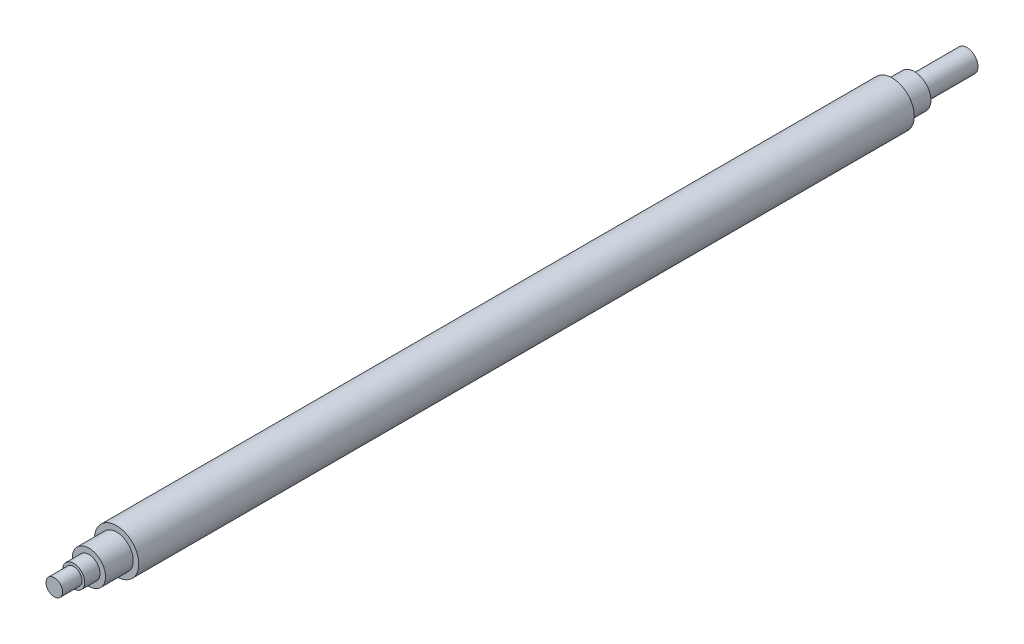
from build123d import *


with BuildPart() as part:
    # Schizzo2 → Rivoluzione2 (revolve)
    with BuildSketch(Plane(origin=(0, 0, 0), x_dir=(0, 0, -1), z_dir=(1, 0, 0)), mode=Mode.PRIVATE) as rivoluzione2_sk:
        Polygon((1.5, 0), (1.5, 3), (8.5, 3), (8.5, 4), (14, 4), (14, 6), (24, 6), (24, 8), (304, 8), (304, 6), (312, 6), (312, 4), (331, 4), (331, 0), align=None)
    revolve(rivoluzione2_sk.sketch.rotate(Axis((0, 0, 0), (0, 0, -1)), 90), axis=Axis((0, 0, 0), (0, 0, -1)))


solid = part.part
